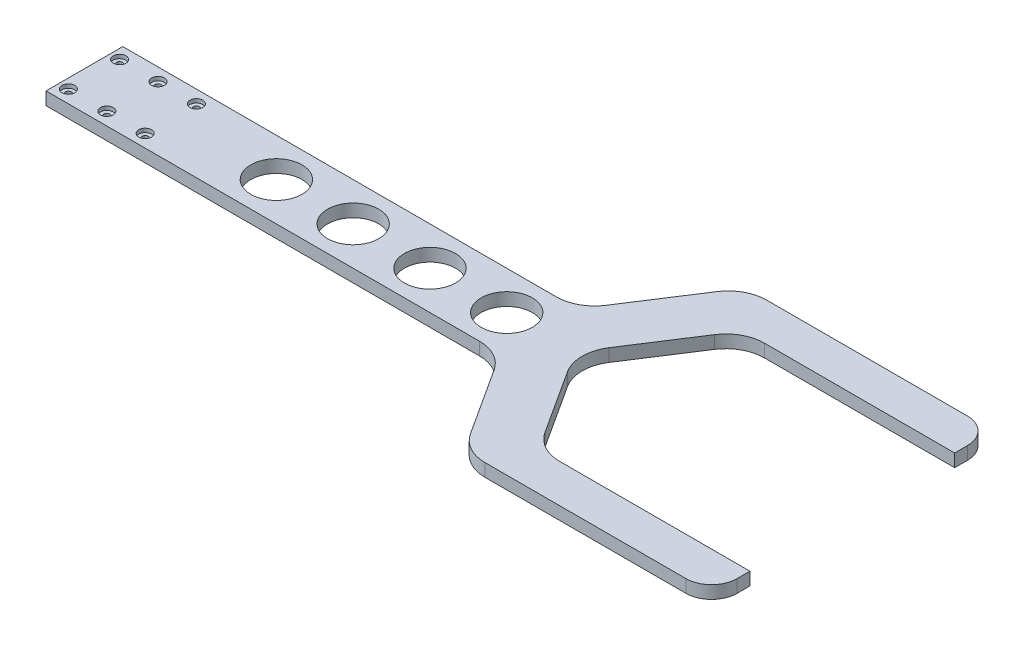
from build123d import *

# Parameters (mm, degrees)
EXTRUDE_1_DEPTH     = 10
SKETCH_3_R          = 20
CUT_EXTRUDE_1_DEPTH = 611.081961707
SKETCH_4_R          = 5
CUT_EXTRUDE_2_DEPTH = 3
SKETCH_5_R          = 2.25
CUT_EXTRUDE_3_DEPTH = 611.040162612


with BuildPart() as part:
    # 스케치1 → 보스-돌출1 (new body)
    with BuildSketch(Plane(origin=(0, 0, 0), x_dir=(1, 0, 0), z_dir=(0, 1, 0))):
        with BuildLine():
            Line((363.866410807, 43.701562934), (397.902344915, 96.298437066))
            ThreePointArc((397.902344915, 96.298437066), (408.752779214, 106.352923101), (423.088868082, 110))
            Line((423.088868082, 110), (580, 110))
            ThreePointArc((580, 110), (594.142135624, 104.142135624), (600, 90))
            Line((600, 90), (600, 80))
            Line((600, 80), (451.32011236, 80))
            ThreePointArc((451.32011236, 80), (436.984023492, 76.352923101), (426.133589193, 66.298437066))
            Line((426.133589193, 66.298437066), (393.778116867, 16.298437066))
            ThreePointArc((393.778116867, 16.298437066), (388.964640033, 0), (393.778116867, -16.298437066))
            Line((393.778116867, -16.298437066), (426.133589193, -66.298437066))
            ThreePointArc((426.133589193, -66.298437066), (436.984023492, -76.352923101), (451.32011236, -80))
            Line((451.32011236, -80), (600, -80))
            Line((600, -80), (600, -90))
            ThreePointArc((600, -90), (594.142135624, -104.142135624), (580, -110))
            Line((580, -110), (423.088868082, -110))
            ThreePointArc((423.088868082, -110), (408.752779214, -106.352923101), (397.902344915, -96.298437066))
            Line((397.902344915, -96.298437066), (363.866410807, -43.701562934))
            ThreePointArc((363.866410807, -43.701562934), (353.015976508, -33.647076899), (338.67988764, -30))
            Line((338.67988764, -30), (0, -30))
            Line((0, -30), (0, 30))
            Line((0, 30), (338.67988764, 30))
            ThreePointArc((338.67988764, 30), (353.015976508, 33.647076899), (363.866410807, 43.701562934))
        make_face()
    extrude(amount=EXTRUDE_1_DEPTH)

    # 스케치3 → 컷-돌출1 (cut, through all)
    with BuildSketch(Plane(origin=(0, 10, 0), x_dir=(1, 0, 0), z_dir=(0, 1, 0))):
        with Locations(Location((150, 0, 0), (0, 0, 270))):
            Circle(SKETCH_3_R)
        with Locations(Location((210, 0, 0), (0, 0, 270))):
            Circle(SKETCH_3_R)
        with Locations(Location((270, 0, 0), (0, 0, 270))):
            Circle(SKETCH_3_R)
        with Locations(Location((330, 0, 0), (0, 0, 270))):
            Circle(SKETCH_3_R)
    extrude(amount=-CUT_EXTRUDE_1_DEPTH, mode=Mode.SUBTRACT)

    # 스케치4 → 컷-돌출2 (cut)
    with BuildSketch(Plane(origin=(0, 10, 0), x_dir=(1, 0, 0), z_dir=(0, 1, 0))):
        with Locations(Location((7.5, 20, 0), (0, 0, 270))):
            Circle(SKETCH_4_R)
        with Locations(Location((37.5, 20, 0), (0, 0, 270))):
            Circle(SKETCH_4_R)
        with Locations(Location((67.5, 20, 0), (0, 0, 270))):
            Circle(SKETCH_4_R)
        with Locations(Location((7.5, -20, 0), (0, 0, 270))):
            Circle(SKETCH_4_R)
        with Locations(Location((37.5, -20, 0), (0, 0, 270))):
            Circle(SKETCH_4_R)
        with Locations(Location((67.5, -20, 0), (0, 0, 270))):
            Circle(SKETCH_4_R)
    extrude(amount=-CUT_EXTRUDE_2_DEPTH, mode=Mode.SUBTRACT)

    # 스케치5 → 컷-돌출3 (cut, through all)
    with BuildSketch(Plane(origin=(0, 7, 0), x_dir=(1, 0, 0), z_dir=(0, 1, 0))):
        with Locations(Location((37.5, 20, 0), (0, 0, 270))):
            Circle(SKETCH_5_R)
        with Locations(Location((67.5, 20, 0), (0, 0, 270))):
            Circle(SKETCH_5_R)
        with Locations(Location((67.5, -20, 0), (0, 0, 270))):
            Circle(SKETCH_5_R)
        with Locations(Location((37.5, -20, 0), (0, 0, 270))):
            Circle(SKETCH_5_R)
        with Locations(Location((7.5, -20, 0), (0, 0, 270))):
            Circle(SKETCH_5_R)
        with Locations(Location((7.5, 20, 0), (0, 0, 270))):
            Circle(SKETCH_5_R)
    extrude(amount=-CUT_EXTRUDE_3_DEPTH, mode=Mode.SUBTRACT)


solid = part.part
